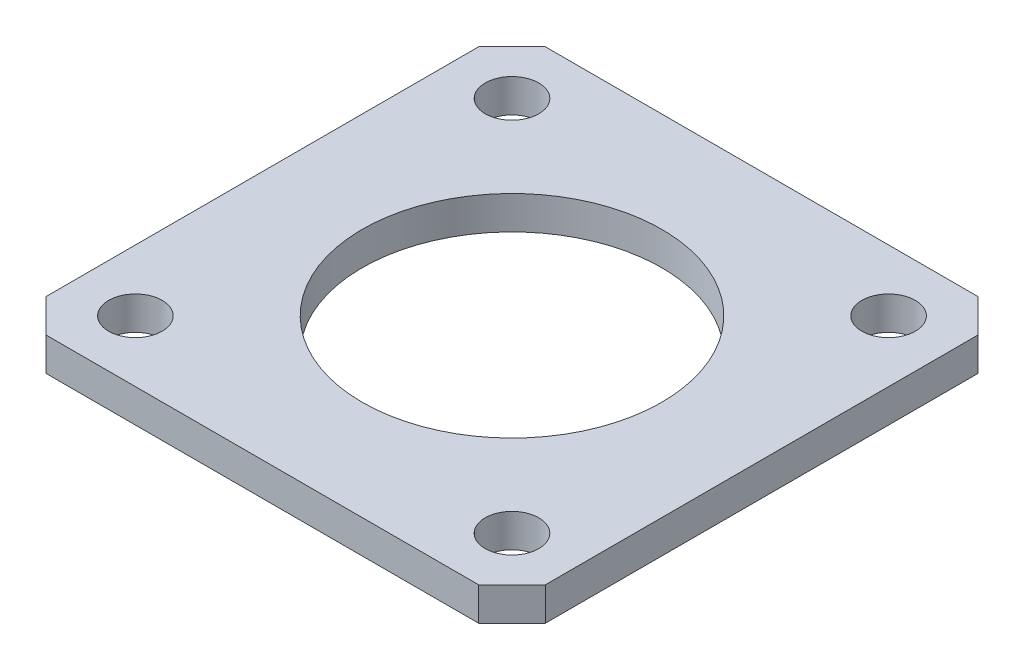
from build123d import *

# Parameters (mm, degrees)
SKETCH1_R           = 2.5527
SKETCH1_R_2         = 14.2875
BOSS_EXTRUDE1_DEPTH = 3.175


with BuildPart() as part:
    # Sketch1 → Boss-Extrude1 (new body)
    with BuildSketch(Plane.XZ):
        Polygon((47.625, -44.45), (47.625, -3.175), (44.45, 0), (3.175, 0), (0, -3.175), (0, -44.45), (3.175, -47.625), (44.45, -47.625), align=None)
        with Locations(Location((5.851987758, -5.851987758, 0), (0, 0, 90))):
            Circle(SKETCH1_R, mode=Mode.SUBTRACT)
        with Locations(Location((41.773012242, -41.773012242, 0), (0, 0, 90))):
            Circle(SKETCH1_R, mode=Mode.SUBTRACT)
        with Locations(Location((23.8125, -23.8125, 0), (0, 0, 90))):
            Circle(SKETCH1_R_2, mode=Mode.SUBTRACT)
        with Locations(Location((5.851987758, -41.773012242, 0), (0, 0, 90))):
            Circle(SKETCH1_R, mode=Mode.SUBTRACT)
        with Locations(Location((41.773012242, -5.851987758, 0), (0, 0, 90))):
            Circle(SKETCH1_R, mode=Mode.SUBTRACT)
    extrude(amount=-BOSS_EXTRUDE1_DEPTH)


solid = part.part
